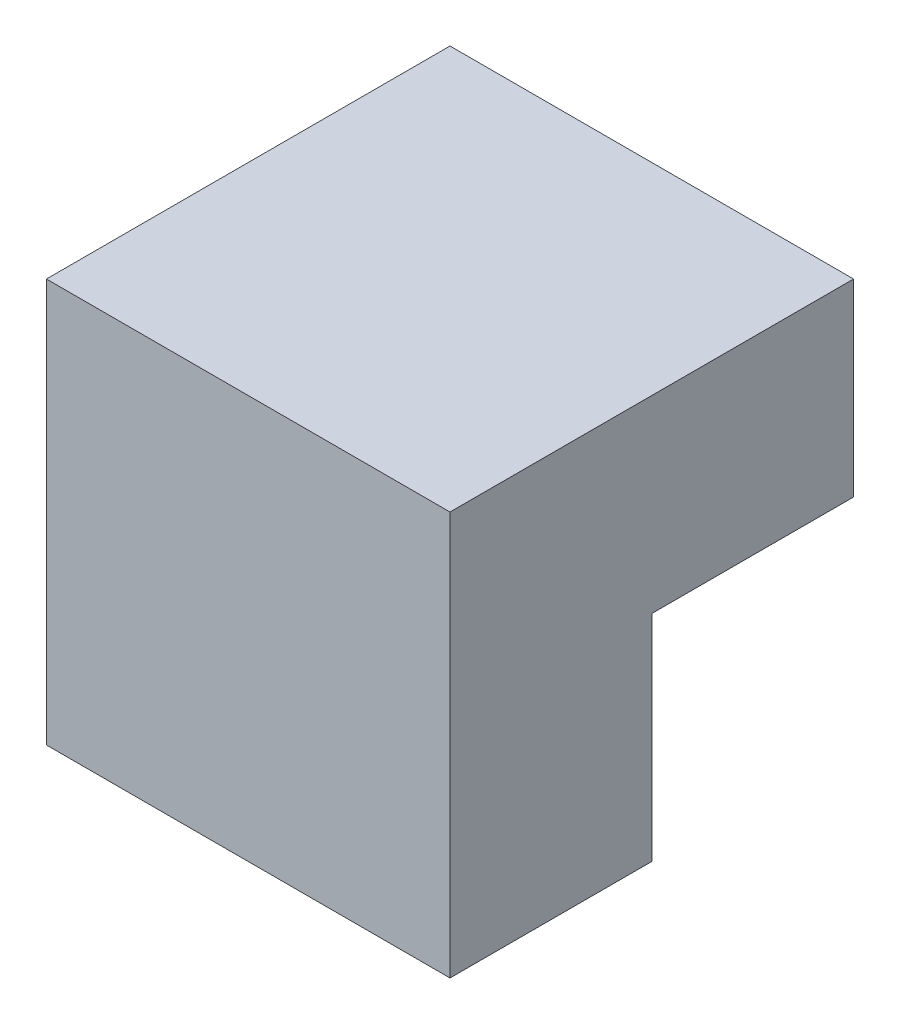
from build123d import *

# Parameters (mm, degrees)
SKETCH_1_W          = 20
SKETCH_1_H          = 20
EXTRUDE_1_DEPTH     = 20
SKETCH_2_R          = 50
CUT_EXTRUDE_1_DEPTH = 10


with BuildPart() as part:
    # 草图1 → 凸台-拉伸1 (new body)
    with BuildSketch(Plane.XY):
        with Locations((2.693416909, -3.487610724)):
            Rectangle(SKETCH_1_W, SKETCH_1_H)
    extrude(amount=EXTRUDE_1_DEPTH)

    # 草图2 → 切除-拉伸1 (cut)
    with BuildSketch(Plane.XY):
        with Locations((3.982384369, -52.080956973)):
            Circle(SKETCH_2_R)
    extrude(amount=CUT_EXTRUDE_1_DEPTH, mode=Mode.SUBTRACT)


solid = part.part
